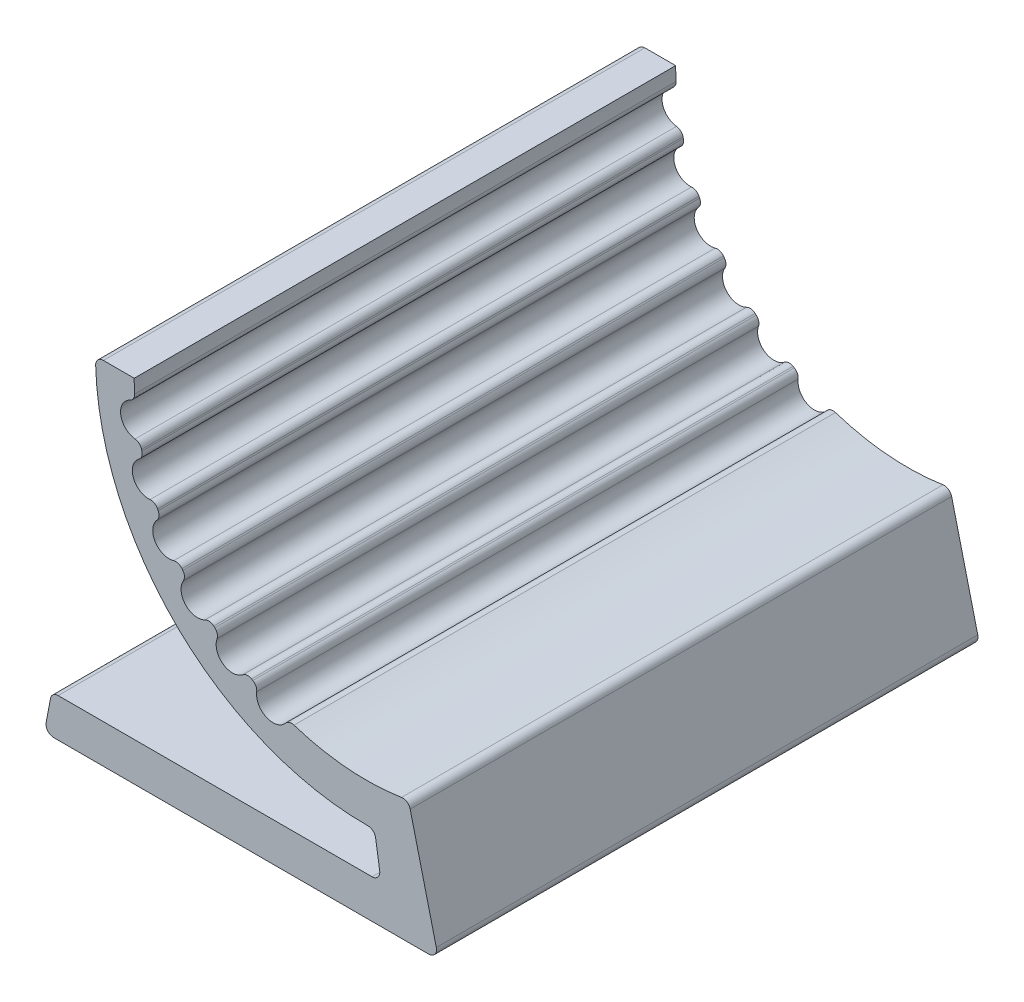
from build123d import *

# Parameters (mm, degrees)
BOSS_EXTRUDE1_DEPTH = 70
FILLET1_R           = 1
FILLET2_R           = 1
FILLET3_R           = 1
FILLET4_R           = 1
FILLET5_R           = 1


with BuildPart() as part:
    # Sketch1 → Boss-Extrude1 (new body)
    with BuildSketch(Plane.XY):
        with BuildLine():
            Line((-30, 0), (-35, 0))
            ThreePointArc((-35, 0), (-24.366509464, -25.125151075), (1.07275523, -34.983556083))
            Line((1.07275523, -34.983556083), (1.913239039, -40.440769755))
            Line((1.913239039, -40.440769755), (-40.664590355, -40.440769755))
            Line((-40.664590355, -40.440769755), (-41.611505919, -45.440769755))
            Line((-41.611505919, -45.440769755), (9.356298233, -45.440769755))
            Line((9.356298233, -45.440769755), (6.644574503, -34.363492687))
            Line((6.644574503, -34.363492687), (5.454004631, -29.500064974))
            ThreePointArc((5.454004631, -29.500064974), (-2.399349656, -29.903898094), (-10.087846616, -28.253059138))
            ThreePointArc((-10.087846616, -28.253059138), (-12.915959233, -29.413373854), (-13.975418711, -26.545953964))
            ThreePointArc((-13.975418711, -26.545953964), (-14.748247142, -26.124494373), (-15.508377464, -25.680541825))
            ThreePointArc((-15.508377464, -25.680541825), (-18.510827542, -26.254862942), (-18.978488477, -23.233961675))
            ThreePointArc((-18.978488477, -23.233961675), (-19.65199094, -22.66714036), (-20.308573214, -22.080802839))
            ThreePointArc((-20.308573214, -22.080802839), (-23.365262749, -22.046157513), (-23.222418703, -18.99261092))
            ThreePointArc((-23.222418703, -18.99261092), (-23.7696551, -18.303100733), (-24.296426035, -17.59783174))
            ThreePointArc((-24.296426035, -17.59783174), (-27.285087446, -16.955605782), (-26.537452182, -13.991555728))
            ThreePointArc((-26.537452182, -13.991555728), (-26.936533055, -13.206937077), (-27.312421814, -12.410947371))
            ThreePointArc((-27.312421814, -12.410947371), (-30.113508646, -11.186829821), (-28.790987573, -8.430838306))
            ThreePointArc((-28.790987573, -8.430838306), (-29.025949689, -7.582495937), (-29.235920721, -6.727625107))
            ThreePointArc((-29.235920721, -6.727625107), (-31.737389499, -4.970580666), (-29.892883462, -2.532887353))
            ThreePointArc((-29.892883462, -2.532887353), (-29.973208903, -1.267575668), (-30, 0))
        make_face()
    extrude(amount=-BOSS_EXTRUDE1_DEPTH)

    # Fillet1
    fillet1_edges = [part.edges().sort_by_distance(p)[0] for p in [
        (5.454004631, -29.500064974, -35),
        (9.356298233, -45.440769755, -35),
        (-41.611505919, -45.440769755, -35),
        (-40.664590355, -40.440769755, -35),
        (1.913239039, -40.440769755, -35),
        (1.07275523, -34.983556083, -35),
        (-35, 0, -35),
    ]]
    fillet(fillet1_edges, radius=FILLET1_R)

    # Fillet2
    fillet2_edges = [part.edges().sort_by_distance(p)[0] for p in [
        (-29.892883462, -2.532887353, -35),
        (-28.790987573, -8.430838306, -35),
        (-26.537452182, -13.991555728, -35),
        (-23.222418703, -18.99261092, -35),
        (-18.978488477, -23.233961675, -35),
        (-13.975418711, -26.545953964, -35),
    ]]
    fillet(fillet2_edges, radius=FILLET2_R)

    # Fillet3
    fillet3_edges = [part.edges().sort_by_distance(p)[0] for p in [
        (-20.308573214, -22.080802839, -35),
        (-15.508377464, -25.680541825, -35),
        (-10.087846616, -28.253059138, -35),
    ]]
    fillet(fillet3_edges, radius=FILLET3_R)

    # Fillet4
    fillet4_edges = [part.edges().sort_by_distance(p)[0] for p in [
        (-27.312421814, -12.410947371, -35),
        (-24.296426035, -17.59783174, -35),
    ]]
    fillet(fillet4_edges, radius=FILLET4_R)

    # Fillet5
    fillet5_edges = [part.edges().sort_by_distance(p)[0] for p in [
        (-29.235920721, -6.727625107, -35),
    ]]
    fillet(fillet5_edges, radius=FILLET5_R)


solid = part.part
